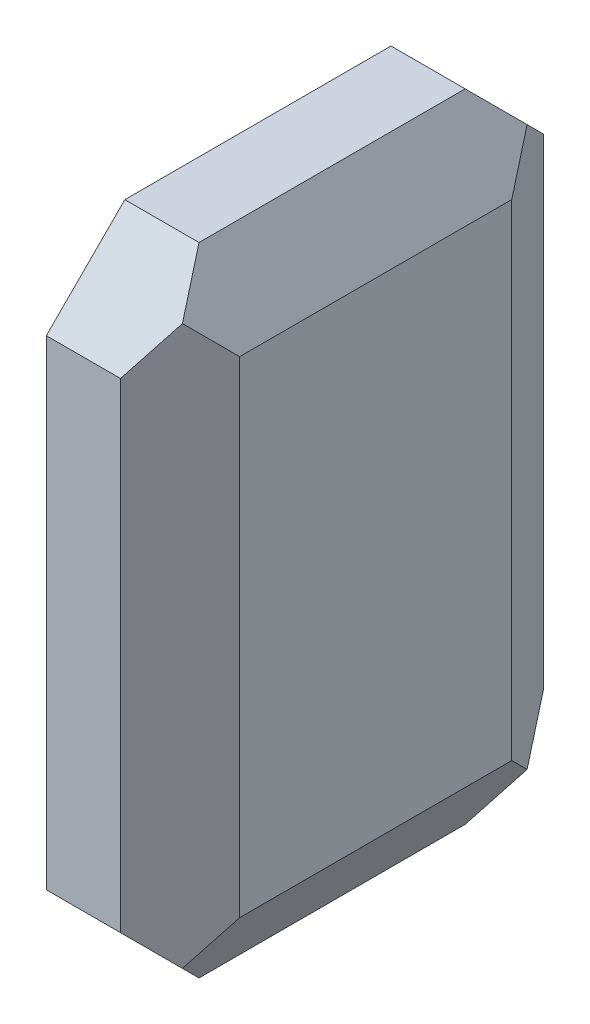
from build123d import *
from OCP.BRepFilletAPI import BRepFilletAPI_MakeChamfer

# Parameters (mm, degrees)
SKETCH1_W               = 37.084
SKETCH1_H               = 24.638
BOSS_EXTRUDE1_DEPTH     = 6.858
CHAMFER2_SIZE           = 4.572
CHAMFER3_SIZE           = 2.54
CHAMFER3_SIZE2          = 4.399409051
CHAMFER4_SIZE           = 2.54
CHAMFER4_SIZE2          = 4.399409051
CUT_EXTRUDE1_DEPTH      = 46.04759998
CUT_EXTRUDE1_DEPTH_BACK = 2.54
SKETCH3_R               = 1


with BuildPart() as part:
    # Sketch1 → Boss-Extrude1 (new body)
    with BuildSketch(Plane.YZ):
        with Locations((18.542, -12.319)):
            Rectangle(SKETCH1_W, SKETCH1_H)
    extrude(amount=BOSS_EXTRUDE1_DEPTH)

    # Chamfer2
    chamfer2_edges = [part.edges().sort_by_distance(p)[0] for p in [
        (3.429, 0, 0),
        (3.429, 37.084, 0),
        (3.429, 37.084, -24.638),
        (3.429, 0, -24.638),
    ]]
    chamfer(chamfer2_edges, length=CHAMFER2_SIZE)

    # Chamfer3: one chamfer whose edges measure the first distance from different faces: ONE call of the kernel's chamfer builder (chamfer() names one face for all edges)
    chamfer3_edges_1 = [part.edges().sort_by_distance(p)[0] for p in [
        (6.858, 18.542, 0),
    ]]
    chamfer3_side_1 = [part.faces().sort_by_distance(p)[0] for p in [
        (3.429, 18.542, 0),
    ]]
    chamfer3_edges_2 = [part.edges().sort_by_distance(p)[0] for p in [
        (6.858, 18.542, -24.638),
    ]]
    chamfer3_side_2 = [part.faces().sort_by_distance(p)[0] for p in [
        (3.429, 18.542, -24.638),
    ]]
    chamfer3 = BRepFilletAPI_MakeChamfer(part.part.solid().wrapped)
    for e in chamfer3_edges_1:
        chamfer3.Add(CHAMFER3_SIZE, CHAMFER3_SIZE2, e.wrapped, chamfer3_side_1[0].wrapped)  # the first distance lies on this face
    for e in chamfer3_edges_2:
        chamfer3.Add(CHAMFER3_SIZE, CHAMFER3_SIZE2, e.wrapped, chamfer3_side_2[0].wrapped)  # the first distance lies on this face
    add(Compound.cast(chamfer3.Shape()), mode=Mode.REPLACE)

    # Chamfer4: one chamfer whose edges measure the first distance from different faces: ONE call of the kernel's chamfer builder (chamfer() names one face for all edges)
    chamfer4_edges_1 = [part.edges().sort_by_distance(p)[0] for p in [
        (6.858, 0, -12.319),
    ]]
    chamfer4_side_1 = [part.faces().sort_by_distance(p)[0] for p in [
        (3.429, 0, -12.319),
    ]]
    chamfer4_edges_2 = [part.edges().sort_by_distance(p)[0] for p in [
        (6.858, 37.084, -12.319),
    ]]
    chamfer4_side_2 = [part.faces().sort_by_distance(p)[0] for p in [
        (3.429, 37.084, -12.319),
    ]]
    chamfer4 = BRepFilletAPI_MakeChamfer(part.part.solid().wrapped)
    for e in chamfer4_edges_1:
        chamfer4.Add(CHAMFER4_SIZE, CHAMFER4_SIZE2, e.wrapped, chamfer4_side_1[0].wrapped)  # the first distance lies on this face
    for e in chamfer4_edges_2:
        chamfer4.Add(CHAMFER4_SIZE, CHAMFER4_SIZE2, e.wrapped, chamfer4_side_2[0].wrapped)  # the first distance lies on this face
    add(Compound.cast(chamfer4.Shape()), mode=Mode.REPLACE)

    # Sketch3 → Cut-Extrude1 (cut, two sides: drawn at the far end of the back side and taken through both)
    with BuildSketch(Plane(origin=(0, 0, 0), x_dir=(0, -1, 0), z_dir=(-1, 0, 0)).offset(-CUT_EXTRUDE1_DEPTH_BACK)):
        with Locations(Location((-8.542, -2.319, 0), (0, 0, 270))):
            Circle(SKETCH3_R)
        with Locations(Location((-8.542, -22.319, 0), (0, 0, 270))):
            Circle(SKETCH3_R)
        with Locations(Location((-28.542, -22.319, 0), (0, 0, 270))):
            Circle(SKETCH3_R)
        with Locations(Location((-28.542, -2.319, 0), (0, 0, 270))):
            Circle(SKETCH3_R)
    extrude(amount=CUT_EXTRUDE1_DEPTH + CUT_EXTRUDE1_DEPTH_BACK, mode=Mode.SUBTRACT)


solid = part.part
